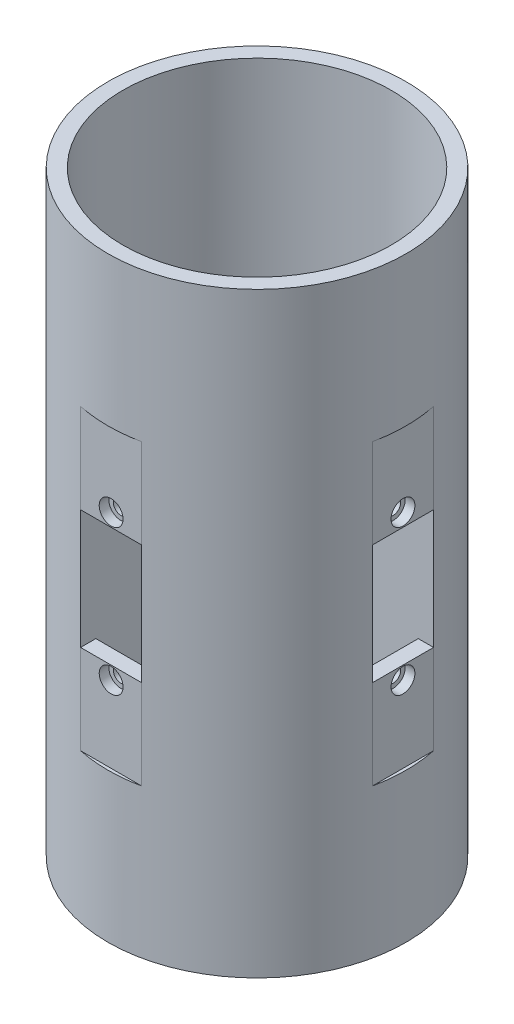
from build123d import *

# Parameters (mm, degrees)
SKETCH_1_R               = 20
SKETCH_1_R_2             = 18
EXTRUDE_1_DEPTH          = 80
EXTRUDE_START            = 25
EXTRUDE_2_DEPTH          = 30
CUT_EXTRUDE_START        = 20
CUT_EXTRUDE_1_DEPTH      = 40
CUT_EXTRUDE_3_DEPTH      = 30
CUT_EXTRUDE_3_DEPTH_BACK = 30
SKETCH_4_W               = 8.2
SKETCH_4_H               = 16
SKETCH_4_R               = 1
CUT_EXTRUDE_4_DEPTH      = 30
CUT_EXTRUDE_4_DEPTH_BACK = 30
SKETCH_5_R               = 1
SKETCH_5_W               = 8.2
SKETCH_5_H               = 16
EXTRUDE_3_DEPTH          = 30
EXTRUDE_START_2          = 39
EXTRUDE_4_DEPTH          = 2
CUT_EXTRUDE_START_2      = 18.275239
SKETCH_8_R               = 1.6
CUT_EXTRUDE_5_DEPTH      = 1.300001
CUT_EXTRUDE_START_3      = -19.57524
SKETCH_9_R               = 1.6
CUT_EXTRUDE_6_DEPTH      = 1.300001
SKETCH_10_R              = 1.6
CUT_EXTRUDE_7_DEPTH      = 1.300001
SKETCH_11_R              = 1.6
CUT_EXTRUDE_8_DEPTH      = 1.300001


with BuildPart() as part:
    # 草图1 → 凸台-拉伸1 (new body)
    with BuildSketch(Plane(origin=(0, 0, 0), x_dir=(1, 0, 0), z_dir=(0, 1, 0))):
        with Locations(Location((0, 0, 0), (0, 0, 270))):
            Circle(SKETCH_1_R)
        with Locations(Location((0, 0, 0), (0, 0, 270))):
            Circle(SKETCH_1_R_2, mode=Mode.SUBTRACT)
    extrude(amount=EXTRUDE_1_DEPTH)

    # 草图2 → 凸台-拉伸2 (add)
    with BuildSketch(Plane(origin=(0, 0, 0), x_dir=(1, 0, 0), z_dir=(0, 1, 0)).offset(EXTRUDE_START)):
        with BuildLine():
            Line((17.526836566, 4.1), (17.526836566, -4.1))
            ThreePointArc((17.526836566, -4.1), (18, 0), (17.526836566, 4.1))
        make_face()
        with BuildLine():
            ThreePointArc((-4.1, -17.526836566), (0, -18), (4.1, -17.526836566))
            Line((4.1, -17.526836566), (-4.1, -17.526836566))
        make_face()
        with BuildLine():
            Line((-4.1, 17.526836566), (4.1, 17.526836566))
            ThreePointArc((4.1, 17.526836566), (0, 18), (-4.1, 17.526836566))
        make_face()
        with BuildLine():
            ThreePointArc((-17.526836566, 4.1), (-18, 0), (-17.526836566, -4.1))
            Line((-17.526836566, -4.1), (-17.526836566, 4.1))
        make_face()
    extrude(amount=EXTRUDE_2_DEPTH)

    # 草图3 → 切除-拉伸1 (cut)
    with BuildSketch(Plane(origin=(0, 0, 0), x_dir=(1, 0, 0), z_dir=(0, 1, 0)).offset(CUT_EXTRUDE_START)):
        with BuildLine():
            Line((-19.575239462, -4.1), (-19.575239462, 4.1))
            ThreePointArc((-19.575239462, 4.1), (-20, 0), (-19.575239462, -4.1))
        make_face()
        with BuildLine():
            Line((4.1, -19.575239462), (-4.1, -19.575239462))
            ThreePointArc((-4.1, -19.575239462), (0, -20), (4.1, -19.575239462))
        make_face()
        with BuildLine():
            ThreePointArc((20, 0), (19.89352645, 2.06097195), (19.575239462, 4.1))
            Line((19.575239462, 4.1), (19.575239462, -4.1))
            ThreePointArc((19.575239462, -4.1), (19.89352645, -2.06097195), (20, 0))
        make_face()
        with BuildLine():
            ThreePointArc((4.1, 19.575239462), (0, 20), (-4.1, 19.575239462))
            Line((-4.1, 19.575239462), (4.1, 19.575239462))
        make_face()
    extrude(amount=CUT_EXTRUDE_1_DEPTH, mode=Mode.SUBTRACT)

    # 草图4 → 切除-拉伸3 (cut, two sides: drawn at the far end of the back side and taken through both)
    with BuildSketch(Plane.XY.offset(-CUT_EXTRUDE_3_DEPTH_BACK)):
        with Locations((0, 40)):
            Rectangle(SKETCH_4_W, SKETCH_4_H)
        with Locations(Location((0, 49.75, 0), (0, 0, 180))):
            Circle(SKETCH_4_R)
        with Locations(Location((0, 30.25, 0), (0, 0, 180))):
            Circle(SKETCH_4_R)
    extrude(amount=CUT_EXTRUDE_3_DEPTH + CUT_EXTRUDE_3_DEPTH_BACK, mode=Mode.SUBTRACT)

    # 草图5 → 切除-拉伸4 (cut, two sides: drawn at the far end of the back side and taken through both)
    with BuildSketch(Plane(origin=(0, 0, 0), x_dir=(0, 0, -1), z_dir=(1, 0, 0)).offset(-CUT_EXTRUDE_4_DEPTH_BACK)):
        with Locations((0, 49.75)):
            Circle(SKETCH_5_R)
        with Locations((0, 30.25)):
            Circle(SKETCH_5_R)
        with Locations((0, 40)):
            Rectangle(SKETCH_5_W, SKETCH_5_H)
    extrude(amount=CUT_EXTRUDE_4_DEPTH + CUT_EXTRUDE_4_DEPTH_BACK, mode=Mode.SUBTRACT)

    # 草图6 → 凸台-拉伸3 (add)
    with BuildSketch(Plane(origin=(0, 0, 0), x_dir=(1, 0, 0), z_dir=(0, 1, 0)).offset(EXTRUDE_START)):
        with BuildLine():
            Line((-4.1, 4.1), (-4.1, 17.526836566))
            ThreePointArc((-4.1, 17.526836566), (-4.854546702, 17.333014058), (-5.6, 17.106723824))
            Line((-5.6, 17.106723824), (-5.6, 5.6))
            Line((-5.6, 5.6), (-17.106723824, 5.6))
            ThreePointArc((-17.106723824, 5.6), (-17.333014058, 4.854546702), (-17.526836566, 4.1))
            Line((-17.526836566, 4.1), (-4.1, 4.1))
        make_face()
        with BuildLine():
            Line((4.1, 4.1), (17.526836566, 4.1))
            ThreePointArc((17.526836566, 4.1), (17.333014058, 4.854546702), (17.106723824, 5.6))
            Line((17.106723824, 5.6), (5.6, 5.6))
            Line((5.6, 5.6), (5.6, 17.106723824))
            ThreePointArc((5.6, 17.106723824), (4.854546702, 17.333014058), (4.1, 17.526836566))
            Line((4.1, 17.526836566), (4.1, 4.1))
        make_face()
        with BuildLine():
            ThreePointArc((17.106723824, -5.6), (17.333014058, -4.854546702), (17.526836566, -4.1))
            Line((17.526836566, -4.1), (4.1, -4.1))
            Line((4.1, -4.1), (4.1, -17.526836566))
            ThreePointArc((4.1, -17.526836566), (4.854546702, -17.333014058), (5.6, -17.106723824))
            Line((5.6, -17.106723824), (5.6, -5.6))
            Line((5.6, -5.6), (17.106723824, -5.6))
        make_face()
        with BuildLine():
            ThreePointArc((-5.6, -17.106723824), (-4.854546702, -17.333014058), (-4.1, -17.526836566))
            Line((-4.1, -17.526836566), (-4.1, -4.1))
            Line((-4.1, -4.1), (-17.526836566, -4.1))
            ThreePointArc((-17.526836566, -4.1), (-17.333014058, -4.854546702), (-17.106723824, -5.6))
            Line((-17.106723824, -5.6), (-5.6, -5.6))
            Line((-5.6, -5.6), (-5.6, -17.106723824))
        make_face()
    extrude(amount=EXTRUDE_3_DEPTH)

    # 草图7 → 凸台-拉伸4 (add)
    # profile 1 of 5: a face of its own
    with BuildSketch(Plane(origin=(0, 0, 0), x_dir=(1, 0, 0), z_dir=(0, 1, 0)).offset(EXTRUDE_START_2)):
        with BuildLine():
            Line((5.6, 5.6), (17.106723824, 5.6))
            ThreePointArc((17.106723824, 5.6), (12.727922061, 12.727922061), (5.6, 17.106723824))
            Line((5.6, 17.106723824), (5.6, 5.6))
        make_face()
        with BuildLine():
            Line((6.865863992, 8.280077554), (10.047844507, 11.46205807))
            ThreePointArc((10.047844507, 11.46205807), (11.46205807, 11.46205807), (11.46205807, 10.047844507))
            Line((11.46205807, 10.047844507), (8.280077554, 6.865863992))
            ThreePointArc((8.280077554, 6.865863992), (6.865863992, 6.865863992), (6.865863992, 8.280077554))
        make_face(mode=Mode.SUBTRACT)
    # profile 2 of 5: a face of its own
    with BuildSketch(Plane(origin=(0, 0, 0), x_dir=(1, 0, 0), z_dir=(0, 1, 0)).offset(EXTRUDE_START_2)):
        with BuildLine():
            Line((17.106723824, -5.6), (5.6, -5.6))
            Line((5.6, -5.6), (5.6, -17.106723824))
            ThreePointArc((5.6, -17.106723824), (12.727922061, -12.727922061), (17.106723824, -5.6))
        make_face()
        with BuildLine():
            ThreePointArc((11.46205807, -10.047844507), (11.46205807, -11.46205807), (10.047844507, -11.46205807))
            Line((10.047844507, -11.46205807), (6.865863992, -8.280077554))
            ThreePointArc((6.865863992, -8.280077554), (6.865863992, -6.865863992), (8.280077554, -6.865863992))
            Line((8.280077554, -6.865863992), (11.46205807, -10.047844507))
        make_face(mode=Mode.SUBTRACT)
    # profile 3 of 5: a face of its own
    with BuildSketch(Plane(origin=(0, 0, 0), x_dir=(1, 0, 0), z_dir=(0, 1, 0)).offset(EXTRUDE_START_2)):
        with BuildLine():
            ThreePointArc((-17.106723824, -5.6), (-12.727922061, -12.727922061), (-5.6, -17.106723824))
            Line((-5.6, -17.106723824), (-5.6, -5.6))
            Line((-5.6, -5.6), (-17.106723824, -5.6))
        make_face()
        with BuildLine():
            Line((-6.865863992, -8.280077554), (-10.047844507, -11.46205807))
            ThreePointArc((-10.047844507, -11.46205807), (-11.46205807, -11.46205807), (-11.46205807, -10.047844507))
            Line((-11.46205807, -10.047844507), (-8.280077554, -6.865863992))
            ThreePointArc((-8.280077554, -6.865863992), (-6.865863992, -6.865863992), (-6.865863992, -8.280077554))
        make_face(mode=Mode.SUBTRACT)
    # profile 4 of 5: a face of its own
    with BuildSketch(Plane(origin=(0, 0, 0), x_dir=(1, 0, 0), z_dir=(0, 1, 0)).offset(EXTRUDE_START_2)):
        with BuildLine():
            Line((-5.6, 5.6), (-5.6, 17.106723824))
            ThreePointArc((-5.6, 17.106723824), (-9.421871257, 15.337155604), (-12.727922061, 12.727922061))
            Line((-12.727922061, 12.727922061), (-11.46205807, 11.46205807))
            ThreePointArc((-11.46205807, 11.46205807), (-10.754951288, 11.754951288), (-10.047844507, 11.46205807))
            Line((-10.047844507, 11.46205807), (-6.865863992, 8.280077554))
            ThreePointArc((-6.865863992, 8.280077554), (-6.572970773, 7.572970773), (-6.865863992, 6.865863992))
            Line((-6.865863992, 6.865863992), (-5.6, 5.6))
        make_face()
    # profile 5 of 5: a face of its own
    with BuildSketch(Plane(origin=(0, 0, 0), x_dir=(1, 0, 0), z_dir=(0, 1, 0)).offset(EXTRUDE_START_2)):
        with BuildLine():
            ThreePointArc((-12.727922061, 12.727922061), (-15.337155604, 9.421871257), (-17.106723824, 5.6))
            Line((-17.106723824, 5.6), (-5.6, 5.6))
            Line((-5.6, 5.6), (-6.865863992, 6.865863992))
            ThreePointArc((-6.865863992, 6.865863992), (-7.572970773, 6.572970773), (-8.280077554, 6.865863992))
            Line((-8.280077554, 6.865863992), (-11.46205807, 10.047844507))
            ThreePointArc((-11.46205807, 10.047844507), (-11.754951288, 10.754951288), (-11.46205807, 11.46205807))
            Line((-11.46205807, 11.46205807), (-12.727922061, 12.727922061))
        make_face()
    extrude(amount=EXTRUDE_4_DEPTH)

    # 草图8 → 切除-拉伸5 (cut)
    with BuildSketch(Plane.XY.offset(CUT_EXTRUDE_START_2)):
        with Locations(Location((0, 49.75, 0), (0, 0, 180))):
            Circle(SKETCH_8_R)
        with Locations(Location((0, 30.25, 0), (0, 0, 180))):
            Circle(SKETCH_8_R)
    extrude(amount=CUT_EXTRUDE_5_DEPTH, mode=Mode.SUBTRACT)

    # 草图9 → 切除-拉伸6 (cut)
    with BuildSketch(Plane.XY.offset(CUT_EXTRUDE_START_3)):
        with Locations(Location((0, 49.75, 0), (0, 0, 180))):
            Circle(SKETCH_9_R)
        with Locations(Location((0, 30.25, 0), (0, 0, 180))):
            Circle(SKETCH_9_R)
    extrude(amount=CUT_EXTRUDE_6_DEPTH, mode=Mode.SUBTRACT)

    # 草图10 → 切除-拉伸7 (cut)
    with BuildSketch(Plane(origin=(0, 0, 0), x_dir=(0, 0, -1), z_dir=(1, 0, 0)).offset(CUT_EXTRUDE_START_3)):
        with Locations((0, 49.75)):
            Circle(SKETCH_10_R)
        with Locations((0, 30.25)):
            Circle(SKETCH_10_R)
    extrude(amount=CUT_EXTRUDE_7_DEPTH, mode=Mode.SUBTRACT)

    # 草图11 → 切除-拉伸8 (cut)
    with BuildSketch(Plane(origin=(0, 0, 0), x_dir=(0, 0, -1), z_dir=(1, 0, 0)).offset(CUT_EXTRUDE_START_2)):
        with Locations((0, 49.75)):
            Circle(SKETCH_11_R)
        with Locations((0, 30.25)):
            Circle(SKETCH_11_R)
    extrude(amount=CUT_EXTRUDE_8_DEPTH, mode=Mode.SUBTRACT)


solid = part.part
